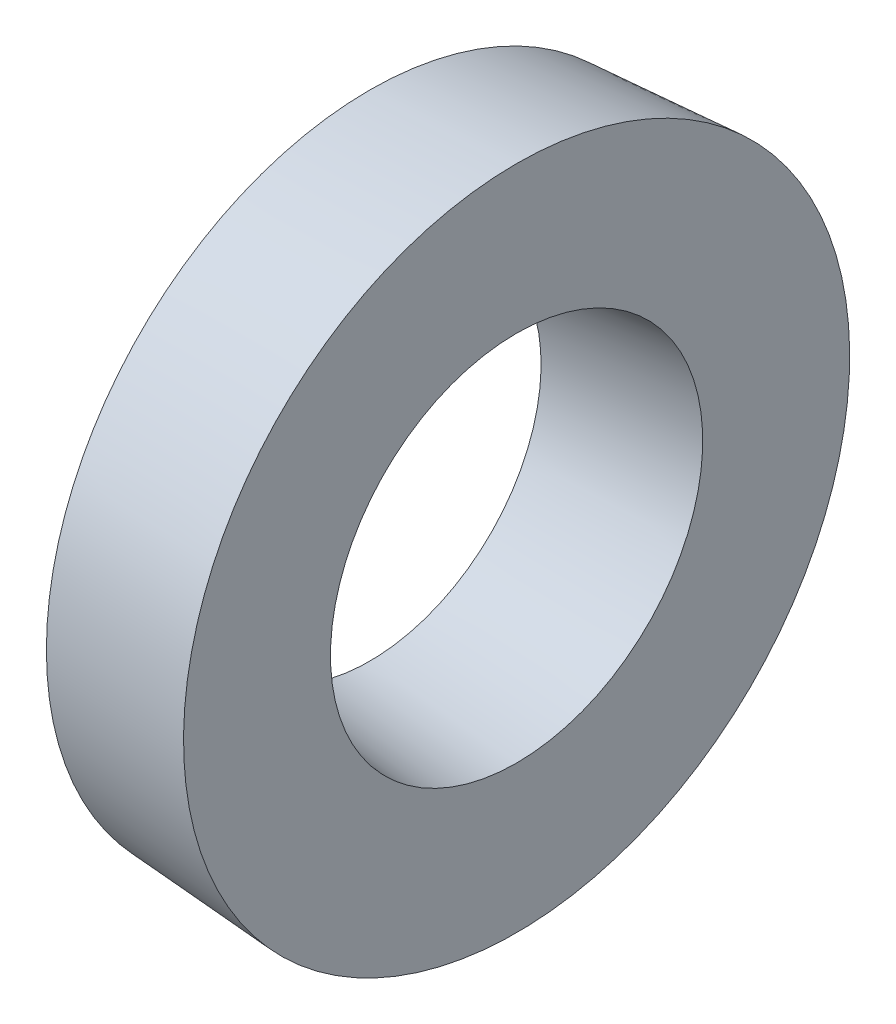
from build123d import *

# Parameters (mm, degrees)
REVOLVE1_ANGLE = 359.999999589


with BuildPart() as part:
    # Sketch1 → Revolve1 (revolve)
    with BuildSketch(Plane.XY):
        Polygon((3400, 350), (3400, 660), (3700, 680), (3700, 380), align=None)
    revolve(axis=Axis((0, 0, 0), (1, 0, 0)), revolution_arc=REVOLVE1_ANGLE)


solid = part.part
